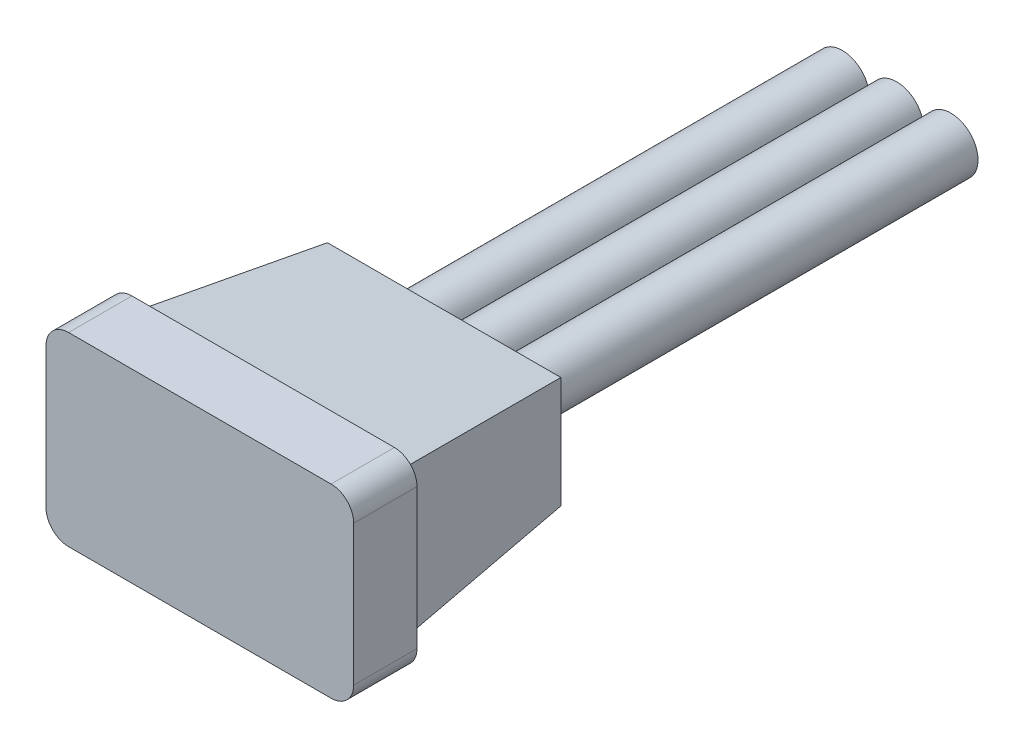
from build123d import *

# Parameters (mm, degrees)
SKETCH1_W           = 6.8
SKETCH1_H           = 4.1
BOSS_EXTRUDE1_DEPTH = 1.4
SKETCH2_W           = 6
SKETCH2_H           = 3.3
BOSS_EXTRUDE2_DEPTH = 4
BOSS_EXTRUDE2_TAPER = 6
FILLET1_R           = 0.5
SKETCH3_R           = 0.6
POSITIVE_DEPTH      = 10
SKETCH4_R           = 0.6
SIGNAL_DEPTH        = 10
SKETCH5_R           = 0.6
NEGATIVE_DEPTH      = 10


with BuildPart() as part:
    # Sketch1 → Boss-Extrude1 (new body)
    with BuildSketch(Plane.XY):
        Rectangle(SKETCH1_W, SKETCH1_H)
    extrude(amount=-BOSS_EXTRUDE1_DEPTH)

    # Sketch2 → Boss-Extrude2 (add)
    with BuildSketch(Plane(origin=(0, 0, -1.4), x_dir=(-1, 0, 0), z_dir=(0, 0, -1))):
        Rectangle(SKETCH2_W, SKETCH2_H)
    extrude(amount=BOSS_EXTRUDE2_DEPTH, taper=BOSS_EXTRUDE2_TAPER)

    # Fillet1
    fillet1_edges = [part.edges().sort_by_distance(p)[0] for p in [
        (3.4, -2.05, -0.7),
        (-3.4, -2.05, -0.7),
        (-3.4, 2.05, -0.7),
        (3.4, 2.05, -0.7),
    ]]
    fillet(fillet1_edges, radius=FILLET1_R)


with BuildPart() as body_2:
    # Sketch3 → POSITIVE (new body)
    with BuildSketch(Plane(origin=(0, 0, -5.4), x_dir=(-1, 0, 0), z_dir=(0, 0, -1))):
        Circle(SKETCH3_R)
    extrude(amount=POSITIVE_DEPTH)


with BuildPart() as body_3:
    # Sketch4 → SIGNAL (new body)
    with BuildSketch(Plane(origin=(0, 0, -5.4), x_dir=(-1, 0, 0), z_dir=(0, 0, -1))):
        with Locations((1.2, 0)):
            Circle(SKETCH4_R)
    extrude(amount=SIGNAL_DEPTH)


with BuildPart() as body_4:
    # Sketch5 → NEGATIVE (new body)
    with BuildSketch(Plane(origin=(0, 0, -5.4), x_dir=(-1, 0, 0), z_dir=(0, 0, -1))):
        with Locations((-1.2, 0)):
            Circle(SKETCH5_R)
    extrude(amount=NEGATIVE_DEPTH)


solid = Compound([part.part, body_2.part, body_3.part, body_4.part])
